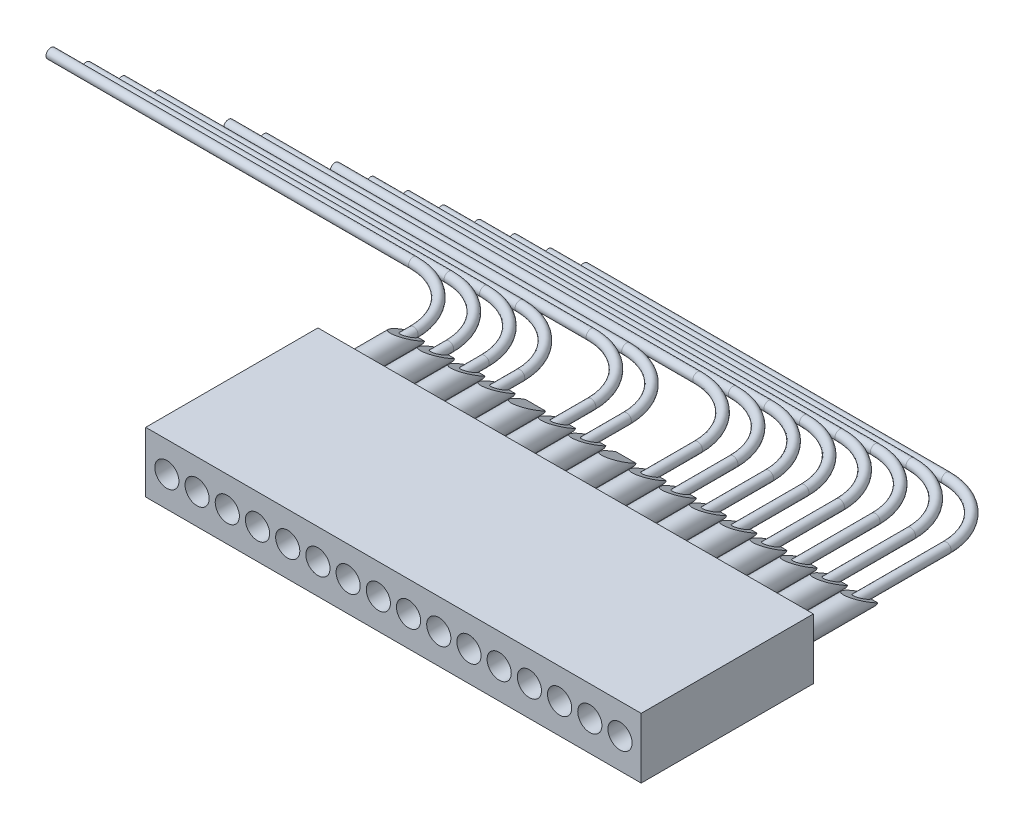
from build123d import *

# Parameters (mm, degrees)
SKETCH1_W               = 20.828
SKETCH1_H               = 7.239
BOSS_EXTRUDE1_DEPTH     = 1.27
SKETCH8_W               = 0.508
SKETCH8_H               = 3.329387454
LPATTERN4_COUNT         = 16
LPATTERN4_PITCH         = 1.27
LPATTERN1_COUNT         = 16
LPATTERN1_PITCH         = 1.27
CUT_EXTRUDE2_DEPTH      = 23.53060179
CUT_EXTRUDE2_DEPTH_BACK = 23.53060179
SKETCH5_R               = 0.2032
LPATTERN2_COUNT         = 17
LPATTERN2_PITCH         = 1.289304


with BuildPart() as part:
    # Sketch1 → Boss-Extrude1 (new, symmetric)
    with BuildSketch(Plane(origin=(0, 0, 0), x_dir=(1, 0, 0), z_dir=(0, 1, 0))):
        with Locations((-9.525, 3.6195)):
            Rectangle(SKETCH1_W, SKETCH1_H)
    extrude(amount=BOSS_EXTRUDE1_DEPTH, both=True)

    # Sketch8 → Cut-Revolve1 (revolve, cut)
    with BuildSketch(Plane(origin=(0, 0, 0), x_dir=(1, 0, 0), z_dir=(0, 1, 0)), mode=Mode.PRIVATE) as cut_revolve1_sk:
        with Locations((0.254, 0.875306273)):
            Rectangle(SKETCH8_W, SKETCH8_H)
    cut_revolve1 = revolve(cut_revolve1_sk.sketch.rotate(Axis((0, 0, 0.789387454), (0, 0, 1)), 180), axis=Axis((0, 0, 0.789387454), (0, 0, 1)), mode=Mode.SUBTRACT)

    # LPattern4: Cut-Revolve1 ×16
    with Locations(*[(-i * LPATTERN4_PITCH, 0, 0) for i in range(1, LPATTERN4_COUNT)]):
        add(cut_revolve1, mode=Mode.SUBTRACT)

    # Sketch3 → Revolve1 (revolve)
    with BuildSketch(Plane(origin=(0, 0, 0), x_dir=(1, 0, 0), z_dir=(0, 1, 0)), mode=Mode.PRIVATE) as revolve1_sk:
        Polygon((0, 10.414), (0.4445, 10.414), (0.4445, 5.08), (0.254, 5.08), (0.254, 3.81), (0, 3.81), align=None)
    revolve1 = revolve(revolve1_sk.sketch.rotate(Axis((0, 0, 2.037124636), (0, 0, 1)), 180), axis=Axis((0, 0, 2.037124636), (0, 0, 1)))

    # LPattern1: Revolve1 ×16
    with Locations(*[(-i * LPATTERN1_PITCH, 0, 0) for i in range(1, LPATTERN1_COUNT)]):
        add(revolve1)

    # Sketch9 → Cut-Extrude2 (cut, two sides: drawn at the far end of the back side and taken through both)
    with BuildSketch(Plane(origin=(0, 0, 0), x_dir=(0, 0, -1), z_dir=(1, 0, 0)).offset(-CUT_EXTRUDE2_DEPTH_BACK)):
        Polygon((10.890417281, 0.763633459), (8.837348051, 0.763633459), (10.890417281, -0.421706614), align=None)
    extrude(amount=CUT_EXTRUDE2_DEPTH + CUT_EXTRUDE2_DEPTH_BACK, mode=Mode.SUBTRACT)

    # Sweep1: sweep along a path in Sketch4
    with BuildLine(Plane(origin=(0, 0, 0), x_dir=(1, 0, 0), z_dir=(0, 1, 0))) as sweep1_path:
        Line((0, 9.144), (0, 13.716))
        ThreePointArc((0, 13.716), (-0.743948776, 15.512051224), (-2.54, 16.256))
        Line((-2.54, 16.256), (-17.78, 16.256))
    # Sketch5 → Sweep1 (sweep)
    with BuildSketch(Plane(origin=(0, 0, -9.144), x_dir=(-1, 0, 0), z_dir=(0, 0, -1))):
        Circle(SKETCH5_R)
    sweep1 = sweep(path=sweep1_path.line)

    # LPattern2: Sweep1 ×17, 3 skipped
    with Locations(*[Vector(-0.9848077530122081, 0, 0.17364817766693033) * (i * LPATTERN2_PITCH) for i in range(1, LPATTERN2_COUNT) if i not in (8, 11, 16)]):
        add(sweep1)


solid = part.part
